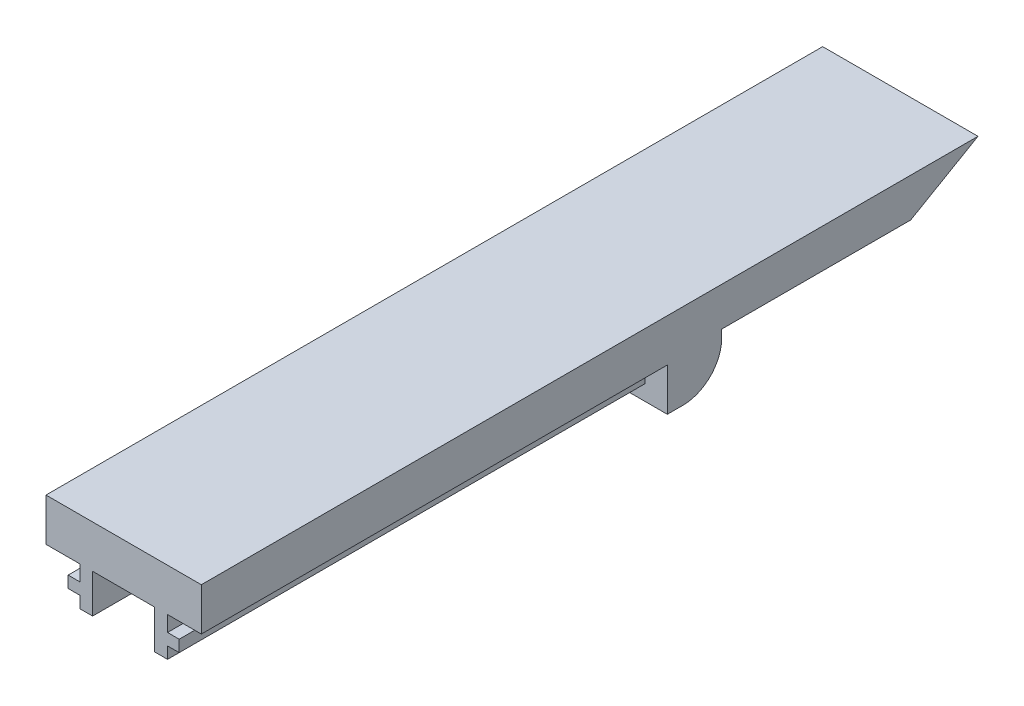
from build123d import *

# Parameters (mm, degrees)
SKETCH1_W           = 20
SKETCH1_H           = 8
BOSS_EXTRUDE1_DEPTH = 100
CUT_EXTRUDE1_DEPTH  = 60
SKETCH3_W           = 20
SKETCH3_H           = 100
BOSS_EXTRUDE2_DEPTH = 3
SKETCH13_W          = 46.736094472
SKETCH13_H          = 63.842099498
CUT_EXTRUDE5_DEPTH  = 30
SKETCH15_W          = 20
SKETCH15_H          = 30
CUT_EXTRUDE6_DEPTH  = 6
FILLET1_R           = 5


with BuildPart() as part:
    # Sketch1 → Boss-Extrude1 (new body)
    with BuildSketch(Plane.XY):
        with Locations((-16.536312849, 6.223463687)):
            Rectangle(SKETCH1_W, SKETCH1_H)
    extrude(amount=-BOSS_EXTRUDE1_DEPTH)

    # Sketch2 → Cut-Extrude1 (cut)
    with BuildSketch(Plane.XY):
        Polygon((-26.536312849, 7.723463687), (-22.186312849, 7.723463687), (-22.186312849, 5.723463687), (-23.686312849, 5.723463687), (-23.686312849, 4.223463687), (-22.186312849, 4.223463687), (-22.186312849, 2.723463687), (-20.536312849, 2.723463687), (-20.536312849, 7.723463687), (-12.536312849, 7.723463687), (-12.536312849, 2.723463687), (-10.886312849, 2.723463687), (-10.886312849, 4.223463687), (-9.386312849, 4.223463687), (-9.386312849, 5.723463687), (-10.886312849, 5.723463687), (-10.886312849, 7.723463687), (-6.536312849, 7.723463687), (-6.536312849, 2.223463687), (-26.536312849, 2.223463687), align=None)
    extrude(amount=-CUT_EXTRUDE1_DEPTH, mode=Mode.SUBTRACT)

    # Sketch3 → Boss-Extrude2 (add)
    with BuildSketch(Plane(origin=(0, 10.223463687, 0), x_dir=(1, 0, 0), z_dir=(0, 1, 0))):
        with Locations((-16.536312849, 50)):
            Rectangle(SKETCH3_W, SKETCH3_H)
    extrude(amount=BOSS_EXTRUDE2_DEPTH)

    # Sketch13 → Cut-Extrude5 (cut)
    with BuildSketch(Plane(origin=(0, -33.383672424, -19.27407226), x_dir=(-1, 0, 0), z_dir=(0, 0.866025403784438, 0.500000000000001))):
        with Locations((16.217588554, -100.321082734)):
            Rectangle(SKETCH13_W, SKETCH13_H)
    extrude(amount=-CUT_EXTRUDE5_DEPTH, mode=Mode.SUBTRACT)

    # Sketch15 → Cut-Extrude6 (cut)
    with BuildSketch(Plane.XZ.offset(-2.223463687)):
        with Locations((-16.536312849, -82)):
            Rectangle(SKETCH15_W, SKETCH15_H)
    extrude(amount=-CUT_EXTRUDE6_DEPTH, mode=Mode.SUBTRACT)

    # Fillet1
    fillet1_edges = [part.edges().sort_by_distance(p)[0] for p in [
        (-16.536312849, 2.223463687, -67),
    ]]
    fillet(fillet1_edges, radius=FILLET1_R)


solid = part.part
